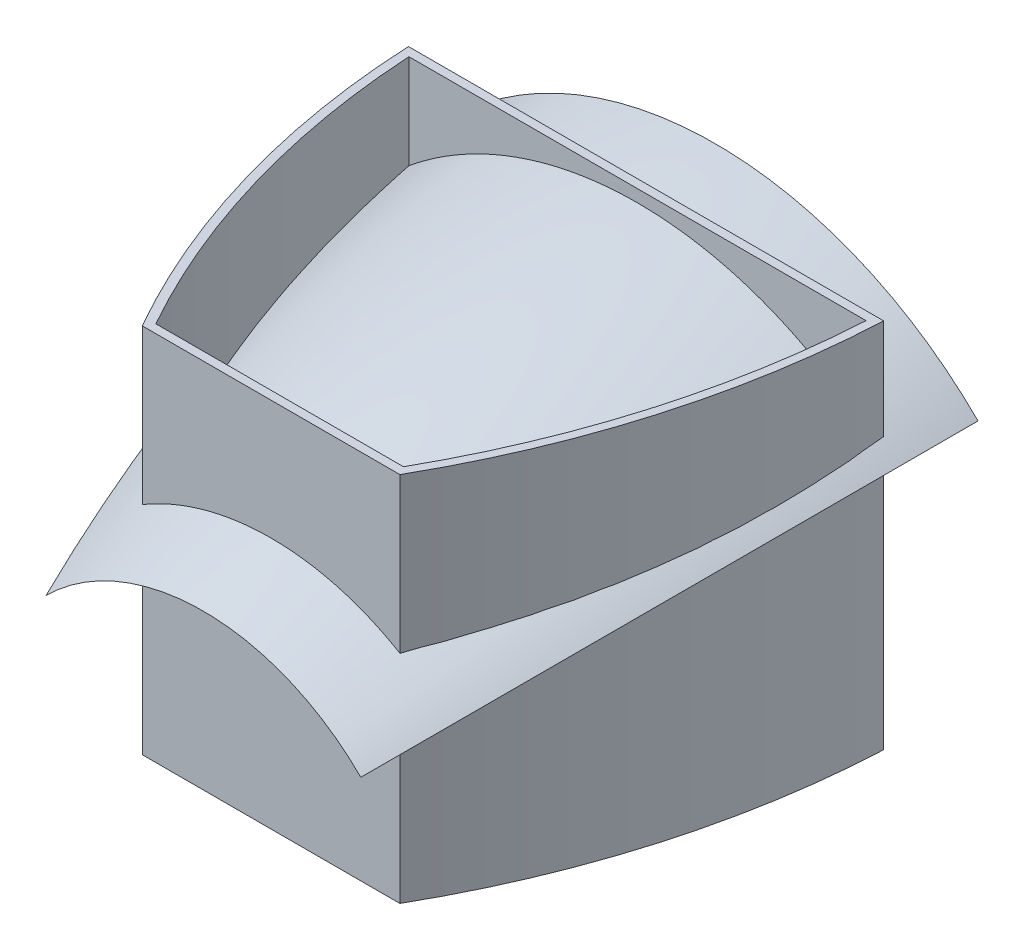
from build123d import *

# Parameters (mm, degrees)
REVOLVE_1_ANGLE = 90
EXTRUDE_1_DEPTH = 129.750797
SHELL_1_T       = -3


with BuildPart() as part:
    # Эскиз3 → Повернуть-Тонкостенный1 (revolve, symmetric)
    with BuildSketch(Plane(origin=(0, 0, 0), x_dir=(0, 0, -1), z_dir=(1, 0, 0))) as revolve_1_sk:
        with BuildLine():
            Line((-154.642813074, 77.760520192), (24.201105378, 129.750796682))
            ThreePointArc((24.201105378, 129.750796682), (-67.165189144, 110.444073397), (-154.642813074, 77.760520192))
        make_face()
        with BuildLine():
            Line((-141, 82.767909565), (10, 126.663904563))
            ThreePointArc((10, 126.663904563), (-66.886042992, 109.48382477), (-141, 82.767909565))
        make_face(mode=Mode.SUBTRACT)
    revolve(axis=Axis((0, 0, 0), (0, 0, 1)), revolution_arc=REVOLVE_1_ANGLE / 2)
    revolve(revolve_1_sk.sketch, axis=Axis((0, 0, 0), (0, 0, -1)), revolution_arc=REVOLVE_1_ANGLE / 2)


with BuildPart() as body_2:
    # Эскиз1 → Бобышка-Вытянуть1 (new body)
    with BuildSketch(Plane(origin=(0, 0, 0), x_dir=(1, 0, 0), z_dir=(0, 1, 0))):
        with BuildLine():
            Line((-45, -131), (45, -131))
            ThreePointArc((45, -131), (71.756415779, -67.749952669), (83, 0))
            Line((83, 0), (-83, 0))
            ThreePointArc((-83, 0), (-71.756415779, -67.749952669), (-45, -131))
        make_face()
    extrude(amount=EXTRUDE_1_DEPTH)

    # Оболочка1
    shell_1_openings = [body_2.faces().sort_by_distance(p)[0] for p in [
        (0, 129.750797, 59.614369669),
    ]]
    offset(amount=SHELL_1_T, openings=shell_1_openings, kind=Kind.INTERSECTION)


solid = Compound([part.part, body_2.part])
